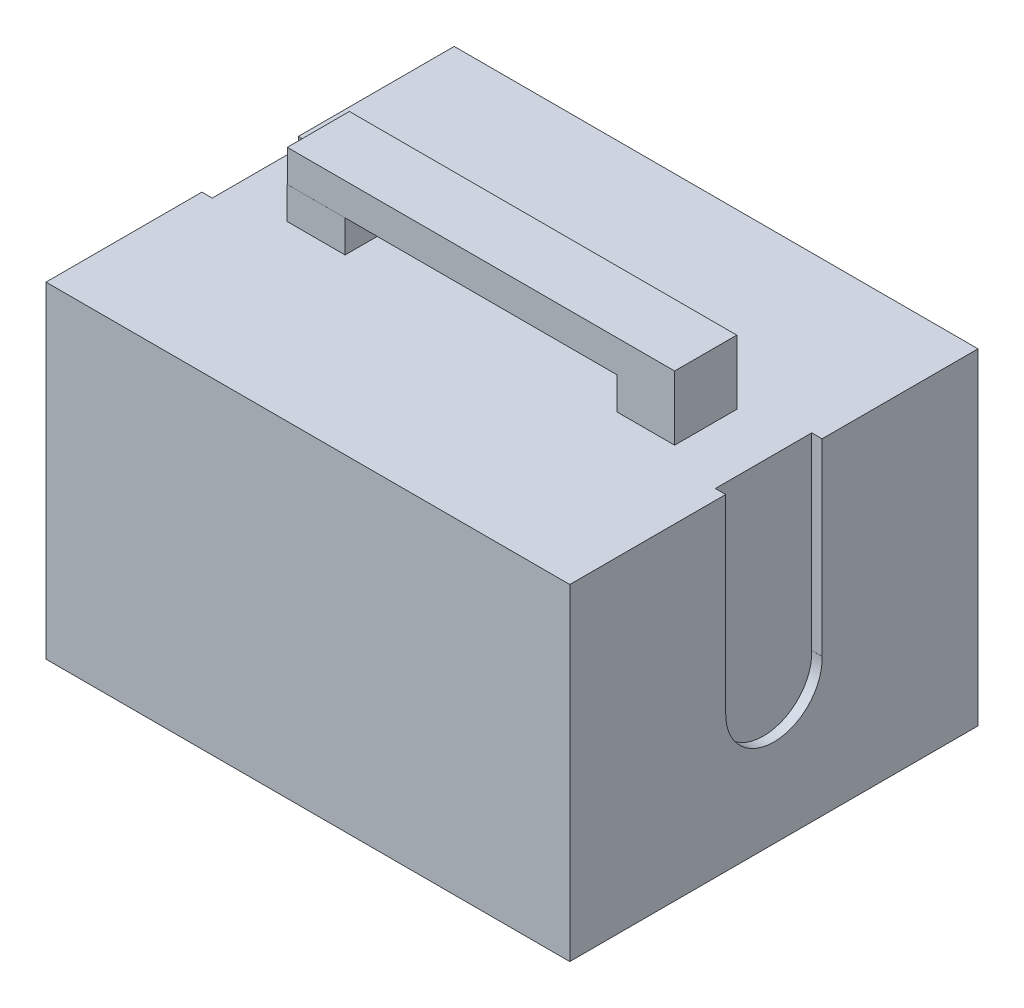
from build123d import *

# Parameters (mm, degrees)
SKETCH2_W           = 162.951605996
SKETCH2_H           = 101.6
BOSS_EXTRUDE1_DEPTH = 127
SKETCH6_W           = 150.072334712
SKETCH6_H           = 88.9
CUT_EXTRUDE1_DEPTH  = 114.3
SKETCH14_W          = 29.9974
SKETCH14_H          = 58.598040667
CUT_EXTRUDE2_DEPTH  = 3.22
SKETCH15_R          = 15
CUT_EXTRUDE3_DEPTH  = 3.22
SKETCH17_W          = 29.9974
SKETCH17_H          = 58.598040667
CUT_EXTRUDE4_DEPTH  = 3.22
CUT_EXTRUDE5_START  = -3.22
SKETCH18_R          = 15
CUT_EXTRUDE5_DEPTH  = 3.22
SKETCH19_W          = 18
SKETCH19_H          = 19.33286688
SKETCH19_H_2        = 19.332866873
BOSS_EXTRUDE2_DEPTH = 10
SKETCH20_W          = 120.511605996
SKETCH20_H          = 19.329300313
BOSS_EXTRUDE3_DEPTH = 10
SKETCH28_W          = 150.072334712
SKETCH28_H          = 88.9
BOSS_EXTRUDE5_DEPTH = 10.33404711
SKETCH29_W          = 78.5832061
SKETCH29_H          = 48.996471626
CUT_EXTRUDE6_DEPTH  = 10.33404711


with BuildPart() as part:
    # Sketch2 → Boss-Extrude1 (new body)
    with BuildSketch(Plane.XY):
        Rectangle(SKETCH2_W, SKETCH2_H)
    extrude(amount=BOSS_EXTRUDE1_DEPTH)

    # Sketch6 → Cut-Extrude1 (cut)
    with BuildSketch(Plane.XY):
        Rectangle(SKETCH6_W, SKETCH6_H)
    extrude(amount=CUT_EXTRUDE1_DEPTH, mode=Mode.SUBTRACT)

    # Sketch14 → Cut-Extrude2 (cut)
    with BuildSketch(Plane.ZY.offset(81.475802998)):
        with Locations((63.5013, 21.500979667)):
            Rectangle(SKETCH14_W, SKETCH14_H)
    extrude(amount=-CUT_EXTRUDE2_DEPTH, mode=Mode.SUBTRACT)

    # Sketch15 → Cut-Extrude3 (cut)
    with BuildSketch(Plane.ZY.offset(81.475802998)):
        with Locations((63.5013, -8.386572038)):
            Circle(SKETCH15_R)
    extrude(amount=-CUT_EXTRUDE3_DEPTH, mode=Mode.SUBTRACT)

    # Sketch17 → Cut-Extrude4 (cut)
    with BuildSketch(Plane(origin=(81.475802998, 0, 0), x_dir=(0, 0, -1), z_dir=(1, 0, 0))):
        with Locations((-63.5013, 21.500979667)):
            Rectangle(SKETCH17_W, SKETCH17_H)
    extrude(amount=-CUT_EXTRUDE4_DEPTH, mode=Mode.SUBTRACT)

    # Sketch18 → Cut-Extrude5 (cut)
    with BuildSketch(Plane(origin=(81.475802998, 0, 0), x_dir=(0, 0, -1), z_dir=(1, 0, 0)).offset(CUT_EXTRUDE5_START)):
        with Locations((-63.5013, -8.386572038)):
            Circle(SKETCH18_R)
    extrude(amount=CUT_EXTRUDE5_DEPTH, mode=Mode.SUBTRACT)

    # Sketch19 → Boss-Extrude2 (add)
    with BuildSketch(Plane(origin=(0, 50.8, 0), x_dir=(1, 0, 0), z_dir=(0, 1, 0))):
        with Locations((-51.255802998, -63.5)):
            Rectangle(SKETCH19_W, SKETCH19_H)
        with Locations((51.255802998, -63.496433436)):
            Rectangle(SKETCH19_W, SKETCH19_H_2)
    extrude(amount=BOSS_EXTRUDE2_DEPTH)

    # Sketch20 → Boss-Extrude3 (add)
    with BuildSketch(Plane(origin=(0, 60.8, 0), x_dir=(1, 0, 0), z_dir=(0, 1, 0))):
        with Locations((0, -63.498216716)):
            Rectangle(SKETCH20_W, SKETCH20_H)
    extrude(amount=BOSS_EXTRUDE3_DEPTH)

    # Sketch28 → Boss-Extrude5 (add)
    with BuildSketch(Plane.XY):
        Rectangle(SKETCH28_W, SKETCH28_H)
    extrude(amount=BOSS_EXTRUDE5_DEPTH)

    # Sketch29 → Cut-Extrude6 (cut)
    with BuildSketch(Plane.XY):
        Rectangle(SKETCH29_W, SKETCH29_H)
    extrude(amount=CUT_EXTRUDE6_DEPTH, mode=Mode.SUBTRACT)


solid = part.part
